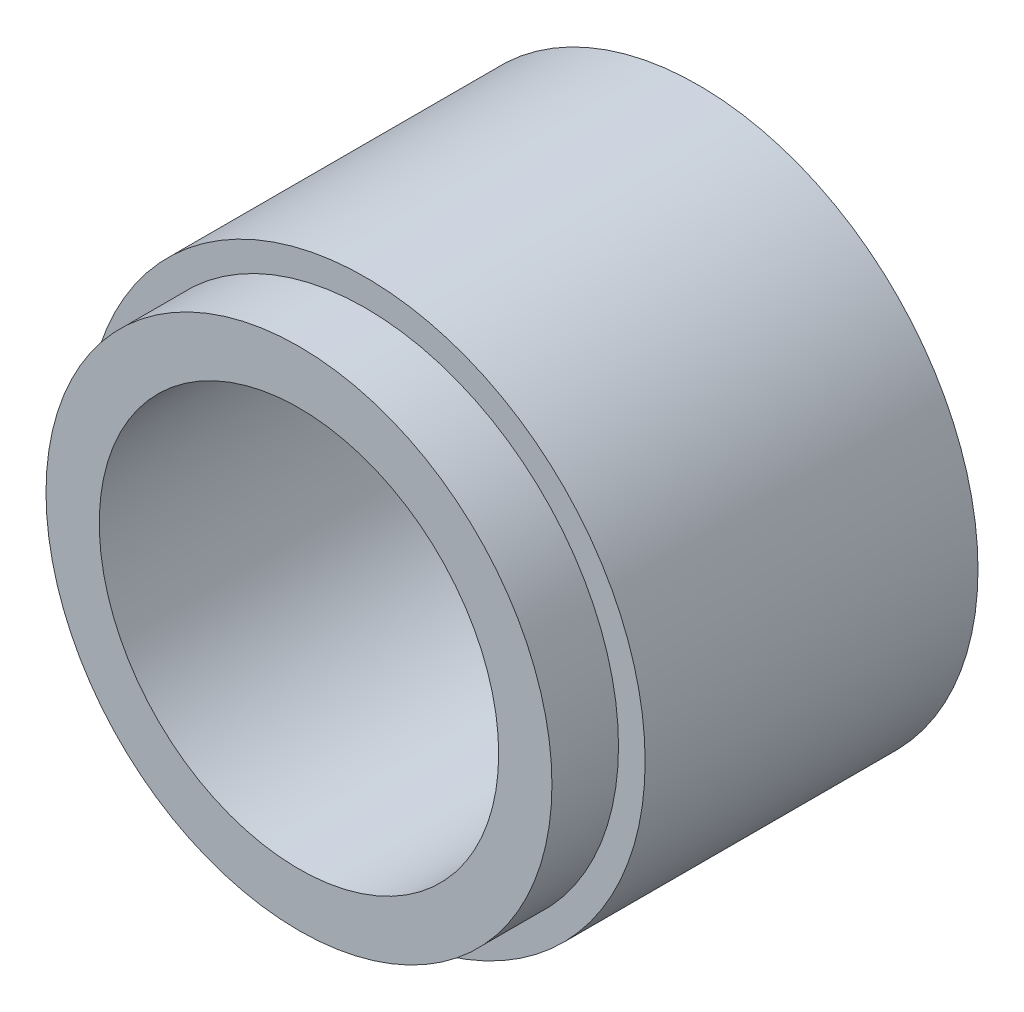
from build123d import *

# Parameters (mm, degrees)
SKETCH_1_R          = 2.1
SKETCH_1_R_2        = 1.5
EXTRUDE_1_DEPTH     = 3
CUT_EXTRUDE_START   = -0.5
SKETCH_2_R          = 2.1
SKETCH_2_R_2        = 1.9
CUT_EXTRUDE_1_DEPTH = 0.5


with BuildPart() as part:
    # 草图1 → 凸台-拉伸1 (new body)
    with BuildSketch(Plane.XY):
        Circle(SKETCH_1_R)
        Circle(SKETCH_1_R_2, mode=Mode.SUBTRACT)
    extrude(amount=EXTRUDE_1_DEPTH)

    # 草图2 → 切除-拉伸1 (cut)
    with BuildSketch(Plane.XY.offset(3).offset(CUT_EXTRUDE_START)):
        Circle(SKETCH_2_R)
        Circle(SKETCH_2_R_2, mode=Mode.SUBTRACT)
    extrude(amount=CUT_EXTRUDE_1_DEPTH, mode=Mode.SUBTRACT)


solid = part.part
